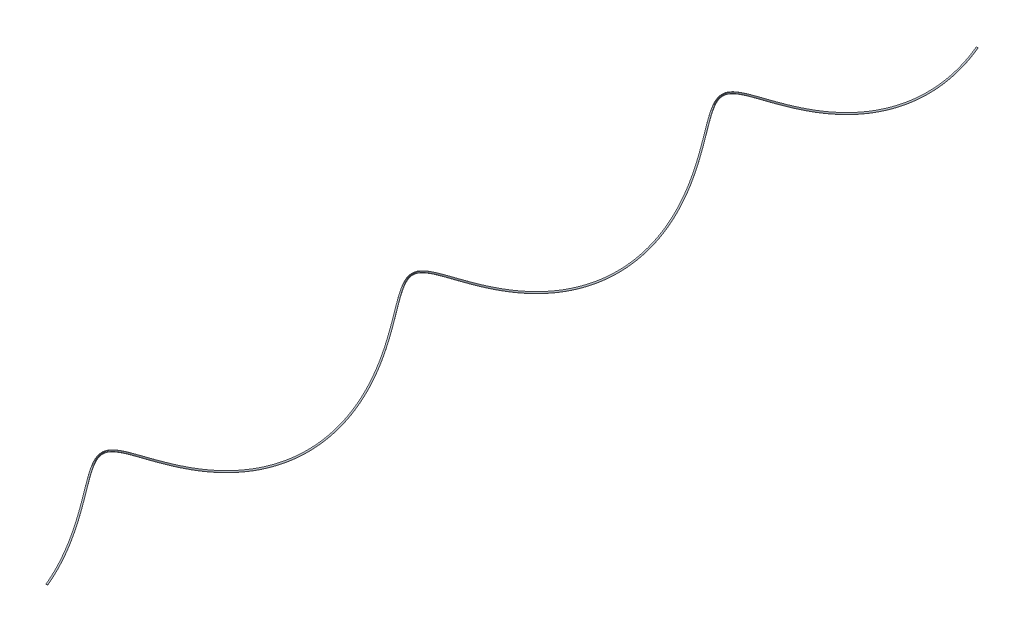
from build123d import *

# Parameters (mm, degrees)
SWEEP1_PITCH  = 21.333333333
SWEEP1_HEIGHT = 64
SWEEP1_RADIUS = 2.5
SKETCH4_R     = 0.05


with BuildPart() as part:
    # Sweep1: sweep along a helix
    with BuildLine() as sweep1_path:
        Helix(SWEEP1_PITCH, SWEEP1_HEIGHT, SWEEP1_RADIUS, center=(0, 0, 0), direction=(0, 0, 1), lefthand=True)
    # Sketch4 → Sweep1 (sweep)
    with BuildSketch(Plane(origin=(2.5, 0, 0), x_dir=(-1, 0, 0), z_dir=(0, -0.5929217026837106, 0.805260116041177))):
        with Locations((0.047003984, 0)):
            Circle(SKETCH4_R)
    sweep(path=sweep1_path.line, is_frenet=True)


solid = part.part
